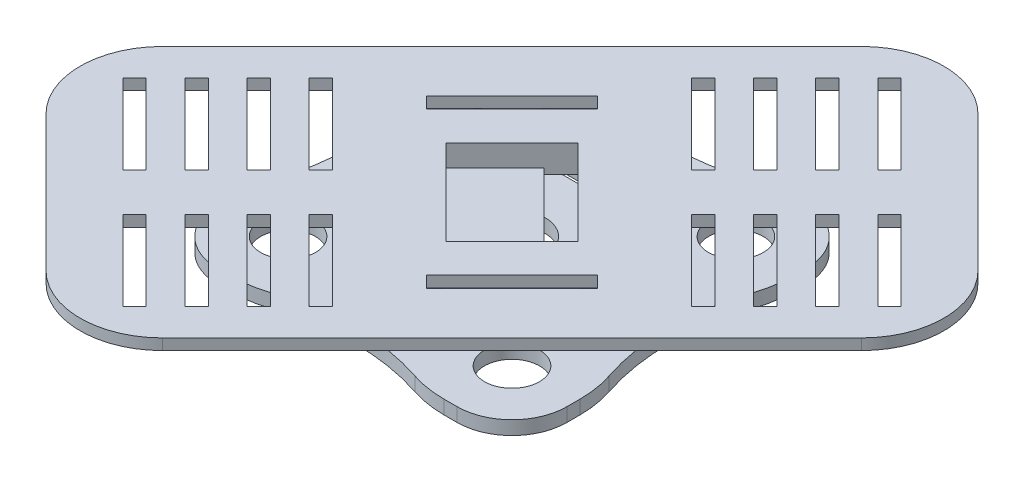
from build123d import *

# Parameters (mm, degrees)
EXTRUDE_1_DEPTH          = 2.5
FILLET_1_R               = 10
FILLET_2_R               = 10
FILLET_3_R               = 10
FILLET_4_R               = 10
SKETCH_2_R               = 5
SKETCH_2_R_2             = 1.52
SKETCH_2_W               = 15
SKETCH_2_H               = 2.887641603
CUT_EXTRUDE_1_DEPTH      = 49
FILLET_5_R               = 20
FILLET_6_R               = 20
PATTERN_CIRCULAR_2_COUNT = 4
CUT_EXTRUDE_2_DEPTH      = 85
CUT_EXTRUDE_2_DEPTH_BACK = 49
SKETCH_3_R               = 6
FILLET_7_R               = 20
FILLET_8_R               = 20
FILLET_9_R               = 20
FILLET_10_R              = 20
FILLET_11_R              = 20
FILLET_12_R              = 20
EXTRUDE_2_DEPTH          = 2
EXTRUDE_3_REACH          = 94.804
SKETCH_6_W               = 3
SKETCH_6_H               = 13.65661591
SKETCH_6_W_2             = 13.65661591
SKETCH_6_H_2             = 3
FILLET_13_R              = 15
FILLET_14_R              = 15
FILLET_15_R              = 15
FILLET_16_R              = 15
CUT_EXTRUDE_3_DEPTH      = 2
PATTERN_LINEAR_1_COUNT   = 4
PATTERN_LINEAR_1_PITCH   = 8
MIRROR_1_COPY_1_DEPTH    = 2
MIRROR_1_COPY_2_DEPTH    = 2
MIRROR_1_COPY_3_DEPTH    = 2
CUT_EXTRUDE_4_DEPTH      = 2
EXTRUDE_4_DEPTH          = 5
CUT_EXTRUDE_5_DEPTH      = 4
CUT_EXTRUDE_6_DEPTH      = 2


with BuildPart() as part:
    # 草图1 → 凸台-拉伸1 (new body)
    with BuildSketch(Plane(origin=(0, 0, 0), x_dir=(1, 0, 0), z_dir=(0, 1, 0))):
        with BuildLine():
            Line((31.819805153, -31.819805153), (15.840551385, -31.819805153))
            ThreePointArc((15.840551385, -31.819805153), (0, -28.683478044), (-15.840551385, -31.819805153))
            Line((-15.840551385, -31.819805153), (-31.819805153, -31.819805153))
            Line((-31.819805153, -31.819805153), (-31.819805153, -15.840551385))
            ThreePointArc((-31.819805153, -15.840551385), (-28.683478044, 0), (-31.819805153, 15.840551385))
            Line((-31.819805153, 15.840551385), (-31.819805153, 31.819805153))
            Line((-31.819805153, 31.819805153), (-15.840551385, 31.819805153))
            ThreePointArc((-15.840551385, 31.819805153), (0, 28.683478044), (15.840551385, 31.819805153))
            Line((15.840551385, 31.819805153), (31.819805153, 31.819805153))
            Line((31.819805153, 31.819805153), (31.819805153, 15.840551385))
            ThreePointArc((31.819805153, 15.840551385), (28.683478044, 0), (31.819805153, -15.840551385))
            Line((31.819805153, -15.840551385), (31.819805153, -31.819805153))
        make_face()
    extrude(amount=EXTRUDE_1_DEPTH)

    # 圆角1
    fillet_1_edges = [part.edges().sort_by_distance(p)[0] for p in [
        (31.819805153, 1.25, 31.819805153),
    ]]
    fillet(fillet_1_edges, radius=FILLET_1_R)

    # 圆角2
    fillet_2_edges = [part.edges().sort_by_distance(p)[0] for p in [
        (31.819805153, 1.25, -31.819805153),
    ]]
    fillet(fillet_2_edges, radius=FILLET_2_R)

    # 圆角3
    fillet_3_edges = [part.edges().sort_by_distance(p)[0] for p in [
        (-31.819805153, 1.25, -31.819805153),
    ]]
    fillet(fillet_3_edges, radius=FILLET_3_R)

    # 圆角4
    fillet_4_edges = [part.edges().sort_by_distance(p)[0] for p in [
        (-31.819805153, 1.25, 31.819805153),
    ]]
    fillet(fillet_4_edges, radius=FILLET_4_R)

    # 草图2 → 切除-拉伸1 (cut)
    with BuildSketch(Plane(origin=(0, 2.5, 0), x_dir=(1, 0, 0), z_dir=(0, 1, 0))):
        with Locations(Location((-20.387793681, 20.387793681, 0), (0, 0, 270))):
            Circle(SKETCH_2_R)
        with Locations((-46.88466688, 53.955734692)):
            Circle(SKETCH_2_R_2)
        with Locations((-53.955734692, 46.88466688)):
            Circle(SKETCH_2_R_2)
        with Locations((0, 15.808482755)):
            Rectangle(SKETCH_2_W, SKETCH_2_H)
    cut_extrude_1 = extrude(amount=-CUT_EXTRUDE_1_DEPTH, mode=Mode.SUBTRACT)

    # 圆角5
    fillet_5_edges = [part.edges().sort_by_distance(p)[0] for p in [
        (-15.840551385, 1.25, -31.819805153),
    ]]
    fillet(fillet_5_edges, radius=FILLET_5_R)

    # 圆角6
    fillet_6_edges = [part.edges().sort_by_distance(p)[0] for p in [
        (-31.819805153, 1.25, -15.840551385),
    ]]
    fillet(fillet_6_edges, radius=FILLET_6_R)

    # 阵列(圆周)2: 切除-拉伸1 ×4 about axis
    pattern_circular_2_axis = Axis((0, 0, 0), (0, 1, 0))
    for i in range(1, PATTERN_CIRCULAR_2_COUNT):
        add(cut_extrude_1.rotate(pattern_circular_2_axis, i * 360 / PATTERN_CIRCULAR_2_COUNT), mode=Mode.SUBTRACT)

    # 草图3 → 切除-拉伸2 (cut, two sides: drawn at the far end of the back side and taken through both)
    with BuildSketch(Plane(origin=(0, 2.5, 0), x_dir=(1, 0, 0), z_dir=(0, 1, 0)).offset(-CUT_EXTRUDE_2_DEPTH_BACK)):
        with Locations(Location((0, 0, 0), (0, 0, 270))):
            Circle(SKETCH_3_R)
    extrude(amount=CUT_EXTRUDE_2_DEPTH + CUT_EXTRUDE_2_DEPTH_BACK, mode=Mode.SUBTRACT)

    # 圆角7
    fillet_7_edges = [part.edges().sort_by_distance(p)[0] for p in [
        (31.819805153, 1.25, 15.840551385),
    ]]
    fillet(fillet_7_edges, radius=FILLET_7_R)

    # 圆角8
    fillet_8_edges = [part.edges().sort_by_distance(p)[0] for p in [
        (15.840551385, 1.25, 31.819805153),
    ]]
    fillet(fillet_8_edges, radius=FILLET_8_R)

    # 圆角9
    fillet_9_edges = [part.edges().sort_by_distance(p)[0] for p in [
        (-31.819805153, 1.25, 15.840551385),
    ]]
    fillet(fillet_9_edges, radius=FILLET_9_R)

    # 圆角10
    fillet_10_edges = [part.edges().sort_by_distance(p)[0] for p in [
        (-15.840551385, 1.25, 31.819805153),
    ]]
    fillet(fillet_10_edges, radius=FILLET_10_R)

    # 圆角11
    fillet_11_edges = [part.edges().sort_by_distance(p)[0] for p in [
        (15.840551385, 1.25, -31.819805153),
    ]]
    fillet(fillet_11_edges, radius=FILLET_11_R)

    # 圆角12
    fillet_12_edges = [part.edges().sort_by_distance(p)[0] for p in [
        (31.819805153, 1.25, -15.840551385),
    ]]
    fillet(fillet_12_edges, radius=FILLET_12_R)

    # 草图6 → 凸台-拉伸3 (add, up to next)
    with BuildSketch(Plane(origin=(0, 7.5, 0), x_dir=(1, 0, 0), z_dir=(0, 1, 0)), mode=Mode.PRIVATE) as extrude_3_sk1:
        with Locations((-24.349602253, 0)):
            Rectangle(SKETCH_6_W, SKETCH_6_H)
    extrude_3_tool1 = extrude(extrude_3_sk1.sketch, amount=-EXTRUDE_3_REACH, mode=Mode.PRIVATE) - part.part
    # 草图6 → 凸台-拉伸3 (add, up to next)
    with BuildSketch(Plane(origin=(0, 7.5, 0), x_dir=(1, 0, 0), z_dir=(0, 1, 0)), mode=Mode.PRIVATE) as extrude_3_sk2:
        with Locations((0, 24.349602253)):
            Rectangle(SKETCH_6_W_2, SKETCH_6_H_2)
    extrude_3_tool2 = extrude(extrude_3_sk2.sketch, amount=-EXTRUDE_3_REACH, mode=Mode.PRIVATE) - part.part
    # 草图6 → 凸台-拉伸3 (add, up to next)
    with BuildSketch(Plane(origin=(0, 7.5, 0), x_dir=(1, 0, 0), z_dir=(0, 1, 0)), mode=Mode.PRIVATE) as extrude_3_sk3:
        with Locations((24.349602253, 0)):
            Rectangle(SKETCH_6_W, SKETCH_6_H)
    extrude_3_tool3 = extrude(extrude_3_sk3.sketch, amount=-EXTRUDE_3_REACH, mode=Mode.PRIVATE) - part.part
    # 草图6 → 凸台-拉伸3 (add, up to next)
    with BuildSketch(Plane(origin=(0, 7.5, 0), x_dir=(1, 0, 0), z_dir=(0, 1, 0)), mode=Mode.PRIVATE) as extrude_3_sk4:
        with Locations((0, -24.349602253)):
            Rectangle(SKETCH_6_W_2, SKETCH_6_H_2)
    extrude_3_tool4 = extrude(extrude_3_sk4.sketch, amount=-EXTRUDE_3_REACH, mode=Mode.PRIVATE) - part.part


with BuildPart() as body_2:
    # 草图5 → 凸台-拉伸2 (new body)
    with BuildSketch(Plane(origin=(0, 7.5, 0), x_dir=(1, 0, 0), z_dir=(0, 1, 0))):
        Polygon((65.40737726, 19.445436483), (19.445436483, 65.40737726), (-65.40737726, -19.445436483), (-19.445436483, -65.40737726), align=None)
    extrude(amount=EXTRUDE_2_DEPTH)


with BuildPart() as part_1:
    add(part.part)

    add(body_2.part)  # 凸台-拉伸3 merges body 2
    add(extrude_3_tool1.solids().sort_by_distance((-24.349602, 7.5, 0))[0])
    add(extrude_3_tool2.solids().sort_by_distance((0, 7.5, -24.349602))[0])
    add(extrude_3_tool3.solids().sort_by_distance((24.349602, 7.5, 0))[0])
    add(extrude_3_tool4.solids().sort_by_distance((0, 7.5, 24.349602))[0])

    # 圆角13
    fillet_13_edges = [part_1.edges().sort_by_distance(p)[0] for p in [
        (65.40737726, 8.5, -19.445436483),
    ]]
    fillet(fillet_13_edges, radius=FILLET_13_R)

    # 圆角14
    fillet_14_edges = [part_1.edges().sort_by_distance(p)[0] for p in [
        (19.445436483, 8.5, -65.40737726),
    ]]
    fillet(fillet_14_edges, radius=FILLET_14_R)

    # 圆角15
    fillet_15_edges = [part_1.edges().sort_by_distance(p)[0] for p in [
        (-19.445436483, 8.5, 65.40737726),
    ]]
    fillet(fillet_15_edges, radius=FILLET_15_R)

    # 圆角16
    fillet_16_edges = [part_1.edges().sort_by_distance(p)[0] for p in [
        (-65.40737726, 8.5, 19.445436483),
    ]]
    fillet(fillet_16_edges, radius=FILLET_16_R)

    # 草图7 → 切除-拉伸3 (cut)
    with BuildSketch(Plane(origin=(0, 9.5, 0), x_dir=(1, 0, 0), z_dir=(0, 1, 0))):
        Polygon((53.433698293, 17.429848032), (38.966382329, 31.897163996), (36.845061986, 29.775843652), (51.31237795, 15.308527688), align=None)
        Polygon((15.308527688, 51.31237795), (29.775843652, 36.845061986), (31.897163996, 38.966382329), (17.429848032, 53.433698293), align=None)
    cut_extrude_3 = extrude(amount=-CUT_EXTRUDE_3_DEPTH, mode=Mode.SUBTRACT)

    # 阵列(线性)1: 切除-拉伸3 ×4
    with Locations(*[Vector(-0.7071067811865438, 0, 0.7071067811865512) * (i * PATTERN_LINEAR_1_PITCH) for i in range(1, PATTERN_LINEAR_1_COUNT)]):
        add(cut_extrude_3, mode=Mode.SUBTRACT)

    # 镜向1: 切除-拉伸3 across plane
    add(cut_extrude_3.mirror(Plane(origin=(0, 0, 0), x_dir=(0.7071067811865477, 0, 0.7071067811865474), z_dir=(0.7071067811865476, 0, -0.7071067811865476))), mode=Mode.SUBTRACT)

    # 镜向1 copy 1 sketch → 镜向1 copy 1 (cut)
    with BuildSketch(Plane(origin=(5.656854249, 9.5, -5.656854249), x_dir=(0, 0, 1), z_dir=(0, 1, 0))):
        Polygon((53.433698293, -17.429848032), (38.966382329, -31.897163996), (36.845061986, -29.775843652), (51.31237795, -15.308527688), align=None)
        Polygon((15.308527688, -51.31237795), (29.775843652, -36.845061986), (31.897163996, -38.966382329), (17.429848032, -53.433698293), align=None)
    extrude(amount=-MIRROR_1_COPY_1_DEPTH, mode=Mode.SUBTRACT)

    # 镜向1 copy 2 sketch → 镜向1 copy 2 (cut)
    with BuildSketch(Plane(origin=(11.313708499, 9.5, -11.313708499), x_dir=(0, 0, 1), z_dir=(0, 1, 0))):
        Polygon((53.433698293, -17.429848032), (38.966382329, -31.897163996), (36.845061986, -29.775843652), (51.31237795, -15.308527688), align=None)
        Polygon((15.308527688, -51.31237795), (29.775843652, -36.845061986), (31.897163996, -38.966382329), (17.429848032, -53.433698293), align=None)
    extrude(amount=-MIRROR_1_COPY_2_DEPTH, mode=Mode.SUBTRACT)

    # 镜向1 copy 3 sketch → 镜向1 copy 3 (cut)
    with BuildSketch(Plane(origin=(16.970562748, 9.5, -16.970562748), x_dir=(0, 0, 1), z_dir=(0, 1, 0))):
        Polygon((53.433698293, -17.429848032), (38.966382329, -31.897163996), (36.845061986, -29.775843652), (51.31237795, -15.308527688), align=None)
        Polygon((15.308527688, -51.31237795), (29.775843652, -36.845061986), (31.897163996, -38.966382329), (17.429848032, -53.433698293), align=None)
    extrude(amount=-MIRROR_1_COPY_3_DEPTH, mode=Mode.SUBTRACT)

    # 草图8 → 切除-拉伸4 (cut)
    with BuildSketch(Plane(origin=(0, 9.5, 0), x_dir=(1, 0, 0), z_dir=(0, 1, 0))):
        Polygon((-7.424621202, 22.980970389), (-22.980970389, 7.424621202), (-20.859650045, 5.303300859), (-5.303300859, 20.859650045), align=None)
        Polygon((20.859650045, -5.303300859), (5.303300859, -20.859650045), (7.424621202, -22.980970389), (22.980970389, -7.424621202), align=None)
    extrude(amount=-CUT_EXTRUDE_4_DEPTH, mode=Mode.SUBTRACT)

    # 草图11 → 凸台-拉伸4 (add)
    with BuildSketch(Plane(origin=(0, 9.5, 0), x_dir=(1, 0, 0), z_dir=(0, 1, 0))):
        Polygon((-15.909902577, 1.767766953), (1.767766953, -15.909902577), (15.909902577, -1.767766953), (-1.767766953, 15.909902577), align=None)
    extrude(amount=-EXTRUDE_4_DEPTH)

    # 草图9 → 切除-拉伸5 (cut)
    with BuildSketch(Plane(origin=(0, 9.5, 0), x_dir=(1, 0, 0), z_dir=(0, 1, 0))):
        Polygon((13.788582233, -1.767766953), (-1.767766953, 13.788582233), (-13.788582233, 1.767766953), (1.767766953, -13.788582233), align=None)
    extrude(amount=-CUT_EXTRUDE_5_DEPTH, mode=Mode.SUBTRACT)

    # 草图12 → 切除-拉伸6 (cut)
    with BuildSketch(Plane(origin=(0, 5.5, 0), x_dir=(1, 0, 0), z_dir=(0, 1, 0))):
        Polygon((-4.843510819, 10.712838367), (-1.719125915, 13.837223271), (13.837223271, -1.719125915), (10.712838367, -4.843510819), align=None)
    extrude(amount=-CUT_EXTRUDE_6_DEPTH, mode=Mode.SUBTRACT)


solid = part_1.part
